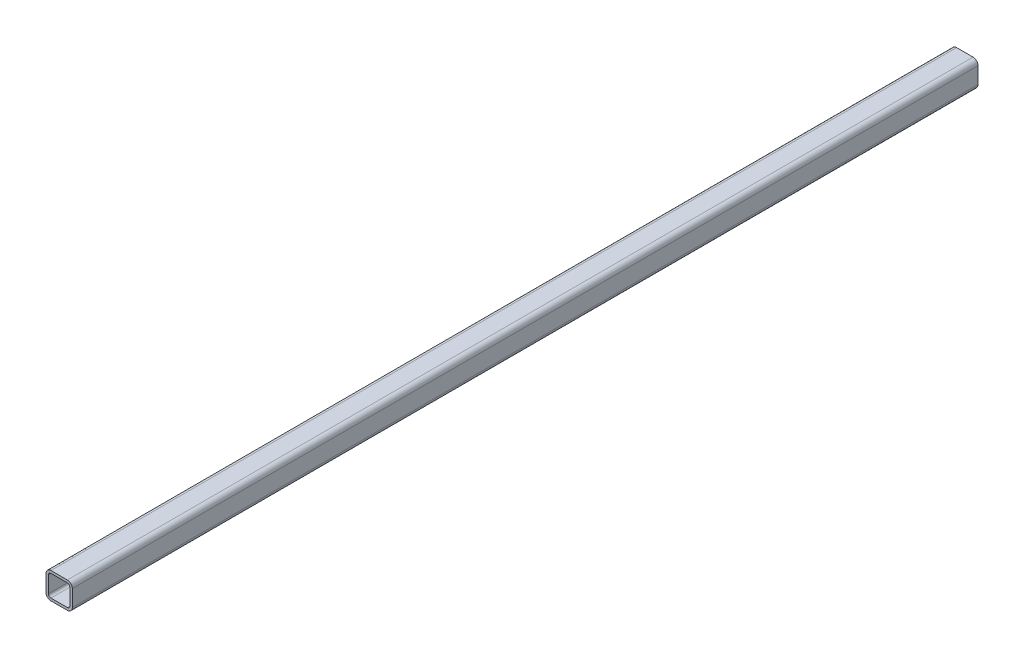
from build123d import *

# Parameters (mm, degrees)
DODANIE_WYCI_GNI_CIE1_DEPTH = 1749.2


with BuildPart() as part:
    # Szkic1 → Dodanie-wyciągnięcie1 (new body)
    with BuildSketch(Plane.XY):
        with BuildLine():
            Line((9.53, 0), (41.27, 0))
            ThreePointArc((41.27, 0), (48.008727625, 2.791272375), (50.8, 9.53))
            Line((50.8, 9.53), (50.8, 41.27))
            ThreePointArc((50.8, 41.27), (48.008727625, 48.008727625), (41.27, 50.8))
            Line((41.27, 50.8), (9.53, 50.8))
            ThreePointArc((9.53, 50.8), (2.791272375, 48.008727625), (0, 41.27))
            Line((0, 41.27), (0, 9.53))
            ThreePointArc((0, 9.53), (2.791272375, 2.791272375), (9.53, 0))
        make_face()
        with BuildLine():
            Line((9.52, 46.04), (41.28, 46.04))
            ThreePointArc((41.28, 46.04), (44.645828278, 44.645828278), (46.04, 41.28))
            Line((46.04, 41.28), (46.04, 9.52))
            ThreePointArc((46.04, 9.52), (44.645828278, 6.154171722), (41.28, 4.76))
            Line((41.28, 4.76), (9.52, 4.76))
            ThreePointArc((9.52, 4.76), (6.154171722, 6.154171722), (4.76, 9.52))
            Line((4.76, 9.52), (4.76, 41.28))
            ThreePointArc((4.76, 41.28), (6.154171722, 44.645828278), (9.52, 46.04))
        make_face(mode=Mode.SUBTRACT)
    extrude(amount=DODANIE_WYCI_GNI_CIE1_DEPTH)


solid = part.part
